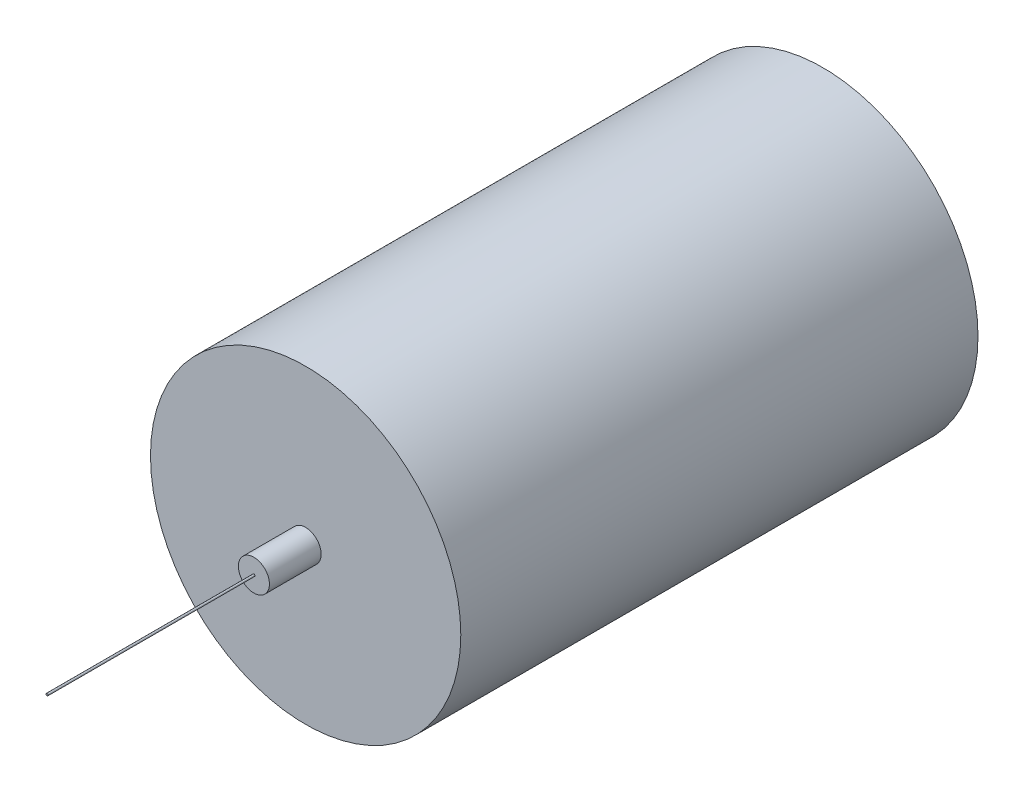
from build123d import *

# Parameters (mm, degrees)
SKETCH1_R           = 1.5
SKETCH1_R_2         = 0.5
BOSS_EXTRUDE1_DEPTH = 4
SKETCH2_R           = 1.5
SKETCH2_R_2         = 0.15
BOSS_EXTRUDE2_DEPTH = 1
SKETCH3_R           = 0.15
BOSS_EXTRUDE3_DEPTH = 0.5
SKETCH4_R           = 0.01
BOSS_EXTRUDE5_DEPTH = 2


with BuildPart() as part:
    # Sketch1 → Boss-Extrude1 (new body)
    with BuildSketch(Plane.XY):
        Circle(SKETCH1_R)
        Circle(SKETCH1_R_2, mode=Mode.SUBTRACT)
    extrude(amount=BOSS_EXTRUDE1_DEPTH)

    # Sketch2 → Boss-Extrude2 (add)
    with BuildSketch(Plane.XY.offset(4)):
        Circle(SKETCH2_R)
        Circle(SKETCH2_R_2, mode=Mode.SUBTRACT)
    extrude(amount=BOSS_EXTRUDE2_DEPTH)


with BuildPart() as body_2:
    # Sketch3 → Boss-Extrude3 (new body)
    with BuildSketch(Plane.XY.offset(5)):
        Circle(SKETCH3_R)
    extrude(amount=BOSS_EXTRUDE3_DEPTH)

    # Sketch4 → Boss-Extrude5 (add)
    with BuildSketch(Plane.XY.offset(5.5)):
        Circle(SKETCH4_R)
    extrude(amount=BOSS_EXTRUDE5_DEPTH)


solid = Compound([part.part, body_2.part])
